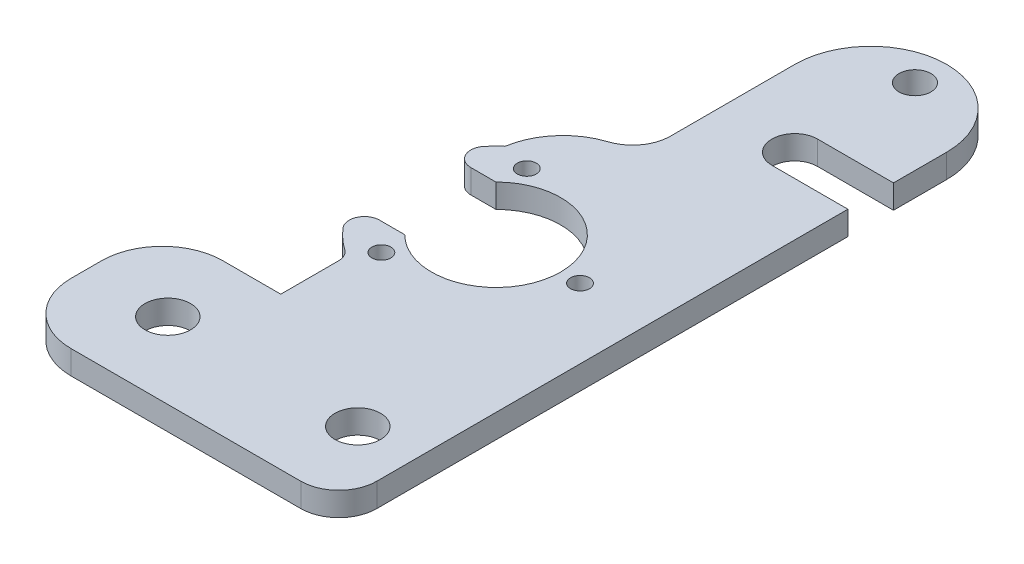
from build123d import *

# Parameters (mm, degrees)
BOSS_EXTRUDE1_DEPTH        = 3.125
CUT_EXTRUDE1_DEPTH         = 195.919695848
F_6_0_6_DIAMETER_HOLE1_D   = 6
F_2_5_2_5_DIAMETER_HOLE1_D = 2.5
F_4_2_4_2_DIAMETER_HOLE1_D = 4.2


with BuildPart() as part:
    # Sketch1 → Boss-Extrude1 (new body)
    with BuildSketch(Plane.XZ.offset(-108.650350882)):
        with BuildLine():
            Line((43.23749287, 110.033281417), (43.23749287, 185.037999923))
            ThreePointArc((43.23749287, 185.037999923), (41.773026776, 188.573533829), (38.23749287, 190.037999923))
            Line((38.23749287, 190.037999923), (7.999992871, 190.037999923))
            ThreePointArc((7.999992871, 190.037999923), (2.343138621, 187.694854172), (-7.129e-06, 182.037999923))
            Line((-7.129e-06, 182.037999923), (-7.129e-06, 178.037999923))
            ThreePointArc((-7.129e-06, 178.037999923), (2.343138621, 172.381145673), (7.999992871, 170.037999923))
            Line((7.999992871, 170.037999923), (15.604000266, 170.037999923))
            Line((15.604000266, 170.037999923), (15.604000266, 162.405058673))
            ThreePointArc((15.604000266, 162.405058673), (15.379885206, 161.485149612), (14.757767585, 160.771406025))
            ThreePointArc((14.757767585, 160.771406025), (13.383453483, 159.667684666), (12.155505046, 158.40313624))
            ThreePointArc((12.155505046, 158.40313624), (11.856365467, 156.265617566), (13.673543586, 155.100999923))
            Line((13.673543586, 155.100999923), (16.979195581, 155.100999923))
            ThreePointArc((16.979195581, 155.100999923), (31.499992871, 149.100999923), (16.979195581, 143.100999923))
            Line((16.979195581, 143.100999923), (13.673543586, 143.100999923))
            ThreePointArc((13.673543586, 143.100999923), (11.856365467, 141.93638228), (12.155505046, 139.798863605))
            ThreePointArc((12.155505046, 139.798863605), (12.809817923, 139.086361098), (13.510844612, 138.419767711))
            ThreePointArc((13.510844612, 138.419767711), (15.615996699, 133.891251825), (19.774392147, 131.125954603))
            ThreePointArc((19.774392147, 131.125954603), (22.280047532, 129.310425898), (23.23749287, 126.368020113))
            Line((23.23749287, 126.368020113), (23.23749287, 110.033281417))
            ThreePointArc((23.23749287, 110.033281417), (33.23749287, 100.033281417), (43.23749287, 110.033281417))
        make_face()
    extrude(amount=-BOSS_EXTRUDE1_DEPTH)

    # Sketch2 → Cut-Extrude1 (cut, through all)
    with BuildSketch(Plane(origin=(0, 111.775350882, 0), x_dir=(-1, 0, 0), z_dir=(0, 1, 0))):
        with BuildLine():
            Line((-43.23749287, 123.037999923), (-43.23749287, 117.037999923))
            Line((-43.23749287, 117.037999923), (-33.23749287, 117.037999923))
            ThreePointArc((-33.23749287, 117.037999923), (-30.23749287, 120.037999923), (-33.23749287, 123.037999923))
            Line((-33.23749287, 123.037999923), (-43.23749287, 123.037999923))
        make_face()
    extrude(amount=-CUT_EXTRUDE1_DEPTH, mode=Mode.SUBTRACT)

    # Ø6.0 (6) Diameter Hole1 (through all)
    with Locations(Plane(origin=(0, 108.650350882, 0), x_dir=(-1, 0, 0), z_dir=(0, -1, 0))):
        with Locations((-10.73749287, -180.037999923), (-35.73749287, -180.037999923)):
            Hole(F_6_0_6_DIAMETER_HOLE1_D / 2)

    # Ø2.5 (2.5) Diameter Hole1 (through all)
    with Locations(Plane(origin=(0, 108.650350882, 0), x_dir=(-1, 0, 0), z_dir=(0, -1, 0))):
        with Locations((-34.048992871, -149.100999923), (-17.475492871, -158.669714609), (-17.475492871, -139.532285236)):
            Hole(F_2_5_2_5_DIAMETER_HOLE1_D / 2)

    # Ø4.2 (4.2) Diameter Hole1 (through all)
    with Locations(Plane(origin=(0, 108.650350882, 0), x_dir=(-1, 0, 0), z_dir=(0, -1, 0))):
        with Locations((-33.23749287, -104.211683364)):
            Hole(F_4_2_4_2_DIAMETER_HOLE1_D / 2)


solid = part.part
